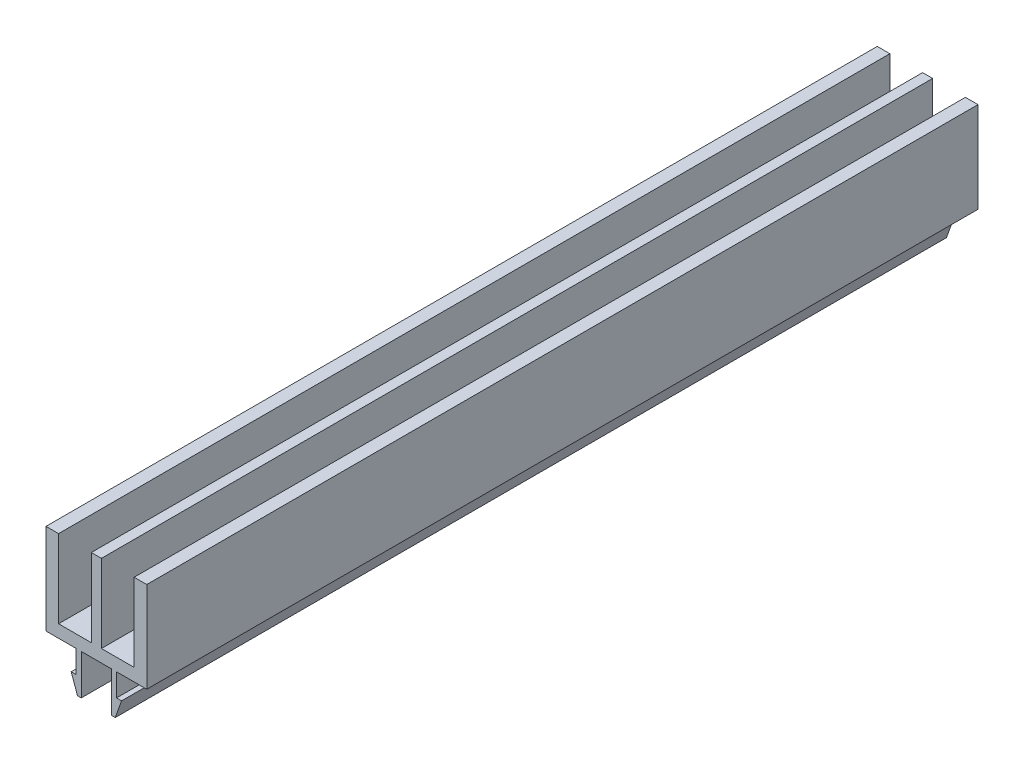
from build123d import *

# Parameters (mm, degrees)
BOSS_EXTRU_1_DEPTH = 165


with BuildPart() as part:
    # Esquisse1 → Boss.-Extru.1 (new body)
    with BuildSketch(Plane.XY.offset(50)):
        Polygon((-1, 2.5), (-7.5, 2.5), (-7.5, 17.999999998), (-10, 17.999999998), (-10, 0), (-4, 0), (-4, -4.5), (-5, -4.5), (-3.75, -8), (-3, -8), (-3, 0), (3, 0), (3, -8), (3.75, -8), (5, -4.5), (4, -4.5), (4, 0), (10, 0), (10, 17.999999998), (7.5, 17.999999998), (7.5, 2.5), (1, 2.5), (1, 17.999999998), (-1, 17.999999998), align=None)
    extrude(amount=-BOSS_EXTRU_1_DEPTH)


solid = part.part
